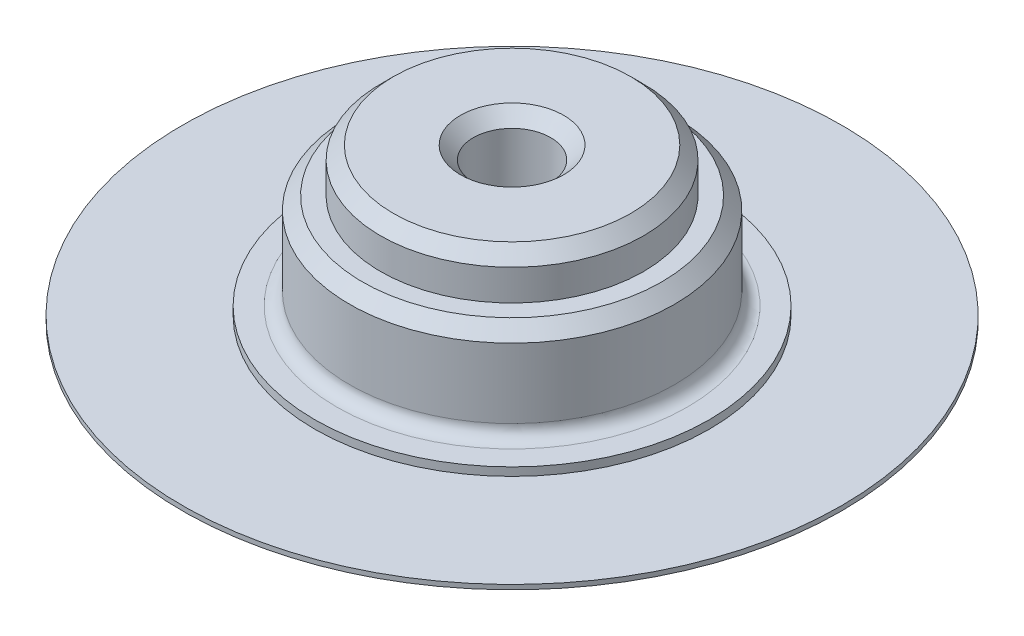
from build123d import *


with BuildPart() as part:
    # Sketch1 → Revolve1 (revolve)
    with BuildSketch(Plane(origin=(0, 0, 0), x_dir=(0, -1, 0), z_dir=(0, 0, -1))):
        with BuildLine():
            Line((0, 1.5), (0, 12.78))
            Line((0, 12.78), (-0.18, 12.78))
            Line((-0.18, 12.78), (-0.18, 7.65))
            Line((-0.18, 7.65), (-0.5, 7.65))
            Line((-0.5, 7.65), (-0.5, 6.8))
            ThreePointArc((-0.5, 6.8), (-0.646446609, 6.446446609), (-1, 6.3))
            Line((-1, 6.3), (-3.7, 6.3))
            Line((-3.7, 6.3), (-4.2, 5.8))
            Line((-4.2, 5.8), (-4.2, 5.1))
            Line((-4.2, 5.1), (-5.4, 5.1))
            Line((-5.4, 5.1), (-5.9, 4.6))
            Line((-5.9, 4.6), (-5.9, 2))
            Line((-5.9, 2), (-5.4, 1.5))
            Line((-5.4, 1.5), (0, 1.5))
        make_face()
    revolve(axis=Axis((0, 0, 0), (0, 1, 0)))


solid = part.part
